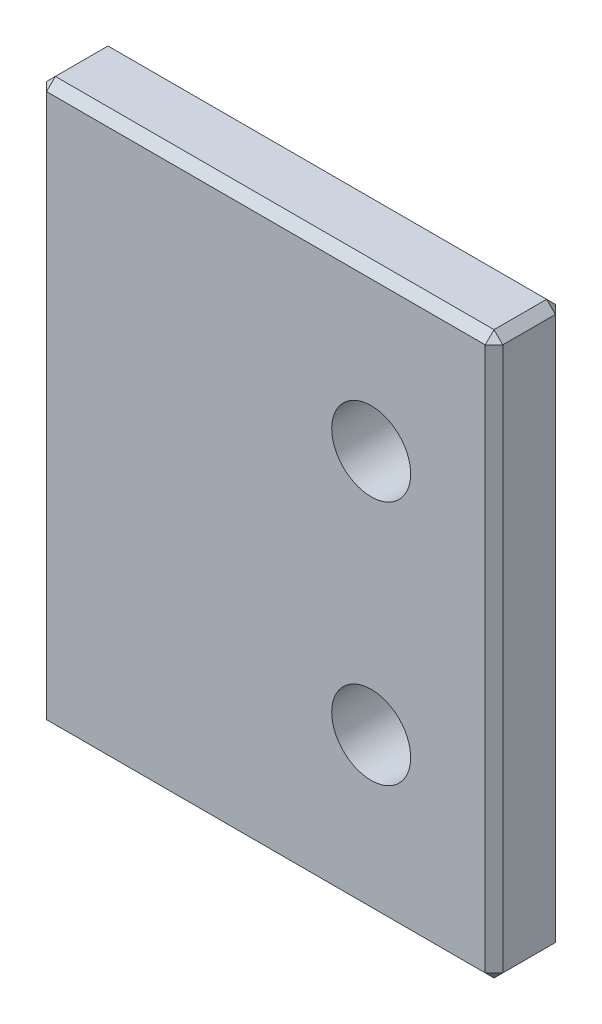
from build123d import *

# Parameters (mm, degrees)
SKETCH_1_W          = 26
SKETCH_1_H          = 32
EXTRUDE_1_DEPTH     = 4
CHAMFER_1_SIZE      = 0.5
SKETCH_2_R          = 2.25
CUT_EXTRUDE_1_DEPTH = 42.424630354


with BuildPart() as part:
    # 草图1 → 凸台-拉伸1 (new body)
    with BuildSketch(Plane.XY):
        with Locations((13, 16)):
            Rectangle(SKETCH_1_W, SKETCH_1_H)
    extrude(amount=EXTRUDE_1_DEPTH)

    # 倒角1
    chamfer_1_edges = [part.edges().sort_by_distance(p)[0] for p in [
        (26, 16, 4),
        (13, 32, 4),
        (0, 16, 4),
        (13, 32, 0),
        (26, 16, 0),
        (13, 0, 0),
        (0, 16, 0),
        (13, 0, 4),
        (0, 32, 2),
        (26, 32, 2),
        (26, 0, 2),
        (0, 0, 2),
    ]]
    chamfer(chamfer_1_edges, length=CHAMFER_1_SIZE)

    # 草图2 → 切除-拉伸1 (cut, through all)
    with BuildSketch(Plane(origin=(0, 0, 0), x_dir=(-1, 0, 0), z_dir=(0, 0, -1))):
        with Locations((-19, 9)):
            Circle(SKETCH_2_R)
        with Locations((-19, 23)):
            Circle(SKETCH_2_R)
    extrude(amount=-CUT_EXTRUDE_1_DEPTH, mode=Mode.SUBTRACT)


solid = part.part
